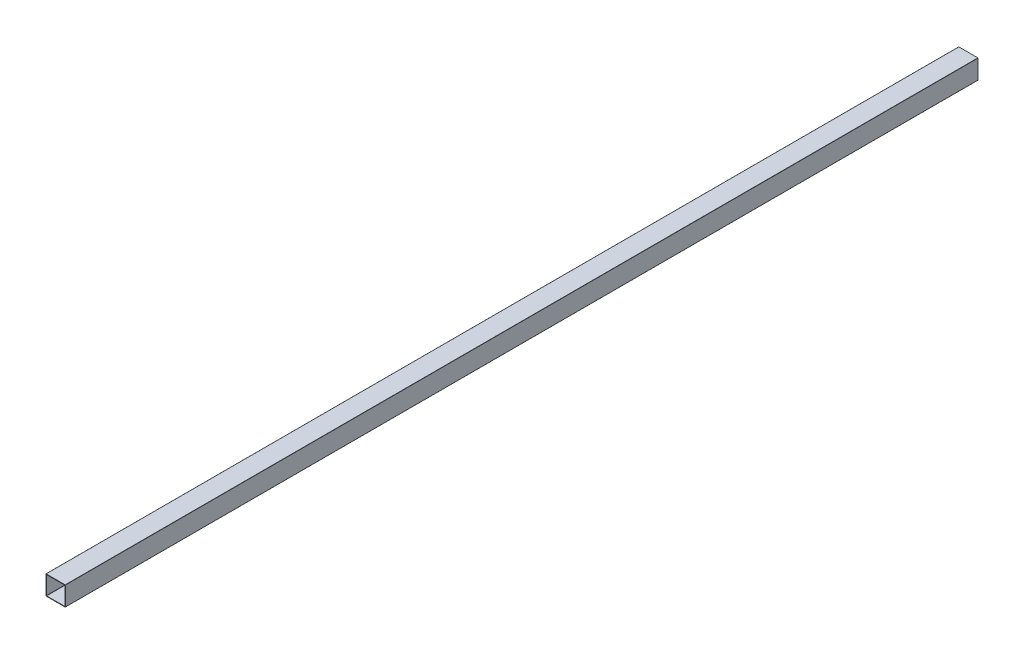
from build123d import *

# Parameters (mm, degrees)
CROQUIS1_W              = 127
CROQUIS1_H              = 127
CROQUIS1_W_2            = 120.92
CROQUIS1_H_2            = 120.92
SALIENTE_EXTRUIR1_DEPTH = 6000
REDONDEO1_R             = 1


with BuildPart() as part:
    # Croquis1 → Saliente-Extruir1 (new body)
    with BuildSketch(Plane.XY):
        Rectangle(CROQUIS1_W, CROQUIS1_H)
        Rectangle(CROQUIS1_W_2, CROQUIS1_H_2, mode=Mode.SUBTRACT)
    extrude(amount=-SALIENTE_EXTRUIR1_DEPTH)

    # Redondeo1
    redondeo1_edges = [part.edges().sort_by_distance(p)[0] for p in [
        (60.46, -60.46, -3000),
        (-60.46, -60.46, -3000),
        (-60.46, 60.46, -3000),
        (60.46, 60.46, -3000),
        (63.5, -63.5, -3000),
        (-63.5, -63.5, -3000),
        (-63.5, 63.5, -3000),
        (63.5, 63.5, -3000),
    ]]
    fillet(redondeo1_edges, radius=REDONDEO1_R)


solid = part.part
